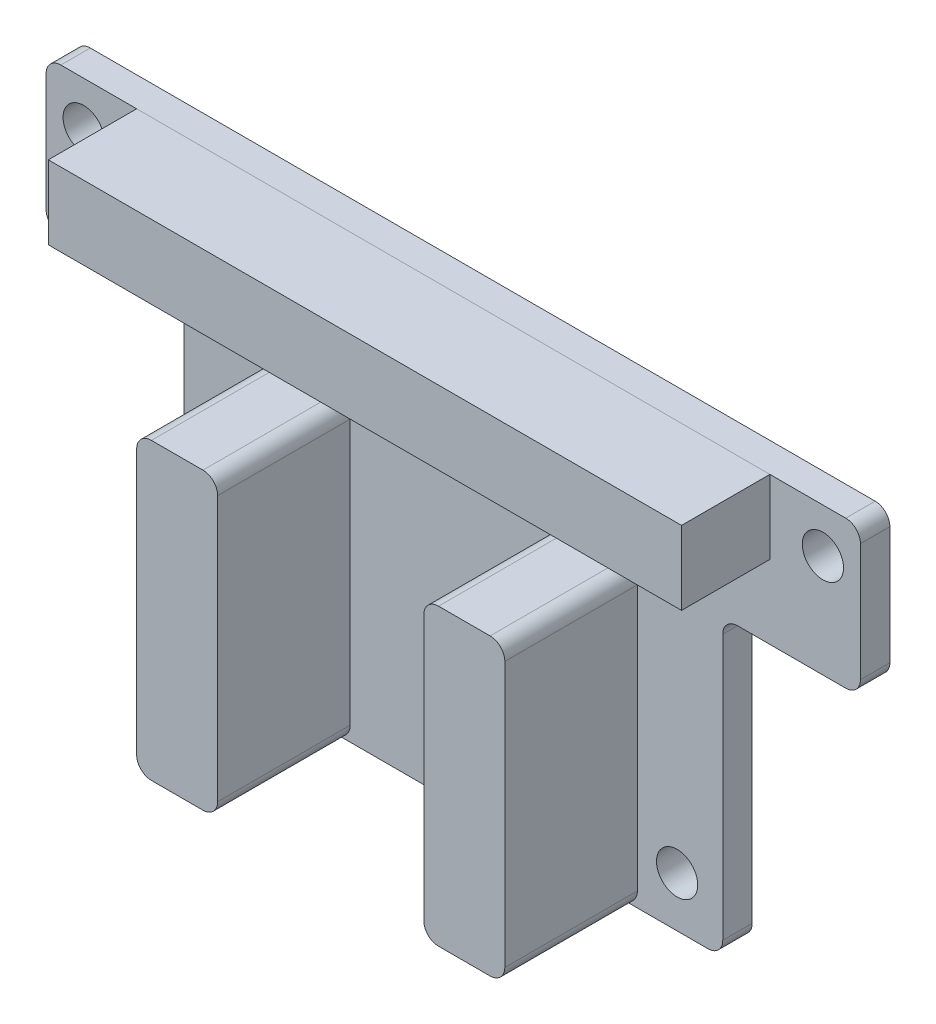
from build123d import *

# Parameters (mm, degrees)
SKETCH_1_W          = 55.3
SKETCH_1_H          = 10
SKETCH_1_W_2        = 36.6
SKETCH_1_H_2        = 20
EXTRUDE_1_DEPTH     = 2
FILLET_1_R          = 1
SKETCH_2_R          = 1.4
CUT_EXTRUDE_1_DEPTH = 2
SKETCH_3_W          = 5.5
SKETCH_3_H          = 20
EXTRUDE_2_DEPTH     = 9
EXTRUDE_2_2_DEPTH   = 9
FILLET_2_R          = 1
FILLET_3_R          = 1
SKETCH_4_W          = 5.5
SKETCH_4_H          = 13
EXTRUDE_3_DEPTH     = 2
EXTRUDE_3_2_DEPTH   = 2
SKETCH_5_W          = 43
SKETCH_5_H          = 5
EXTRUDE_4_DEPTH     = 6


with BuildPart() as part:
    # 草图1 → 凸台-拉伸1 (new body)
    with BuildSketch(Plane.XY):
        Rectangle(SKETCH_1_W, SKETCH_1_H)
        with Locations((0, -15)):
            Rectangle(SKETCH_1_W_2, SKETCH_1_H_2)
    extrude(amount=EXTRUDE_1_DEPTH)

    # 圆角1
    fillet_1_edges = [part.edges().sort_by_distance(p)[0] for p in [
        (27.65, -5, 1),
        (18.3, -5, 1),
        (18.3, -25, 1),
        (-18.3, -25, 1),
        (-18.3, -5, 1),
        (-27.65, -5, 1),
        (-27.65, 5, 1),
        (27.65, 5, 1),
    ]]
    fillet(fillet_1_edges, radius=FILLET_1_R)

    # 草图2 → 切除-拉伸1 (cut)
    with BuildSketch(Plane.XY.offset(2)):
        with Locations((-25.1, 2)):
            Circle(SKETCH_2_R)
        with Locations((-15.2, -21.6)):
            Circle(SKETCH_2_R)
        with Locations(Location((15.2, -21.6, 0), (0, 0, 180))):
            Circle(SKETCH_2_R)
        with Locations(Location((25.1, 2, 0), (0, 0, 180))):
            Circle(SKETCH_2_R)
    extrude(amount=-CUT_EXTRUDE_1_DEPTH, mode=Mode.SUBTRACT)


with BuildPart() as body_2:
    # 草图3 → 凸台-拉伸2 (new body)
    with BuildSketch(Plane.XY.offset(2)):
        with Locations((-9.75, -15)):
            Rectangle(SKETCH_3_W, SKETCH_3_H)
    extrude(amount=EXTRUDE_2_DEPTH)

    # 圆角2
    fillet_2_edges = [body_2.edges().sort_by_distance(p)[0] for p in [
        (-12.5, -5, 6.5),
        (-7, -5, 6.5),
        (-7, -25, 6.5),
        (-12.5, -25, 6.5),
    ]]
    fillet(fillet_2_edges, radius=FILLET_2_R)


with BuildPart() as body_3:
    # 草图3 → Extrude 2 2 (new body)
    with BuildSketch(Plane.XY.offset(2)):
        with Locations((9.75, -15)):
            Rectangle(SKETCH_3_W, SKETCH_3_H)
    extrude(amount=EXTRUDE_2_2_DEPTH)

    # 圆角3
    fillet_3_edges = [body_3.edges().sort_by_distance(p)[0] for p in [
        (7, -25, 6.5),
        (7, -5, 6.5),
        (12.5, -5, 6.5),
        (12.5, -25, 6.5),
    ]]
    fillet(fillet_3_edges, radius=FILLET_3_R)


with BuildPart() as body_4:
    # 草图4 → 凸台-拉伸3 (new body)
    with BuildSketch(Plane(origin=(0, 0, 0), x_dir=(-1, 0, 0), z_dir=(0, 0, -1))):
        with Locations((-9.75, -10.5)):
            Rectangle(SKETCH_4_W, SKETCH_4_H)
    extrude(amount=EXTRUDE_3_DEPTH)


with BuildPart() as body_5:
    # 草图4 → Extrude 3 2 (new body)
    with BuildSketch(Plane(origin=(0, 0, 0), x_dir=(-1, 0, 0), z_dir=(0, 0, -1))):
        with Locations((9.75, -10.5)):
            Rectangle(SKETCH_4_W, SKETCH_4_H)
    extrude(amount=EXTRUDE_3_2_DEPTH)


with BuildPart() as body_6:
    # 草图5 → 凸台-拉伸4 (new body)
    with BuildSketch(Plane(origin=(0, 0, 2), x_dir=(-1, 0, 0), z_dir=(0, 0, -1))):
        with Locations((0, 2.5)):
            Rectangle(SKETCH_5_W, SKETCH_5_H)
    extrude(amount=-EXTRUDE_4_DEPTH)


solid = Compound([part.part, body_2.part, body_3.part, body_4.part, body_5.part, body_6.part])
